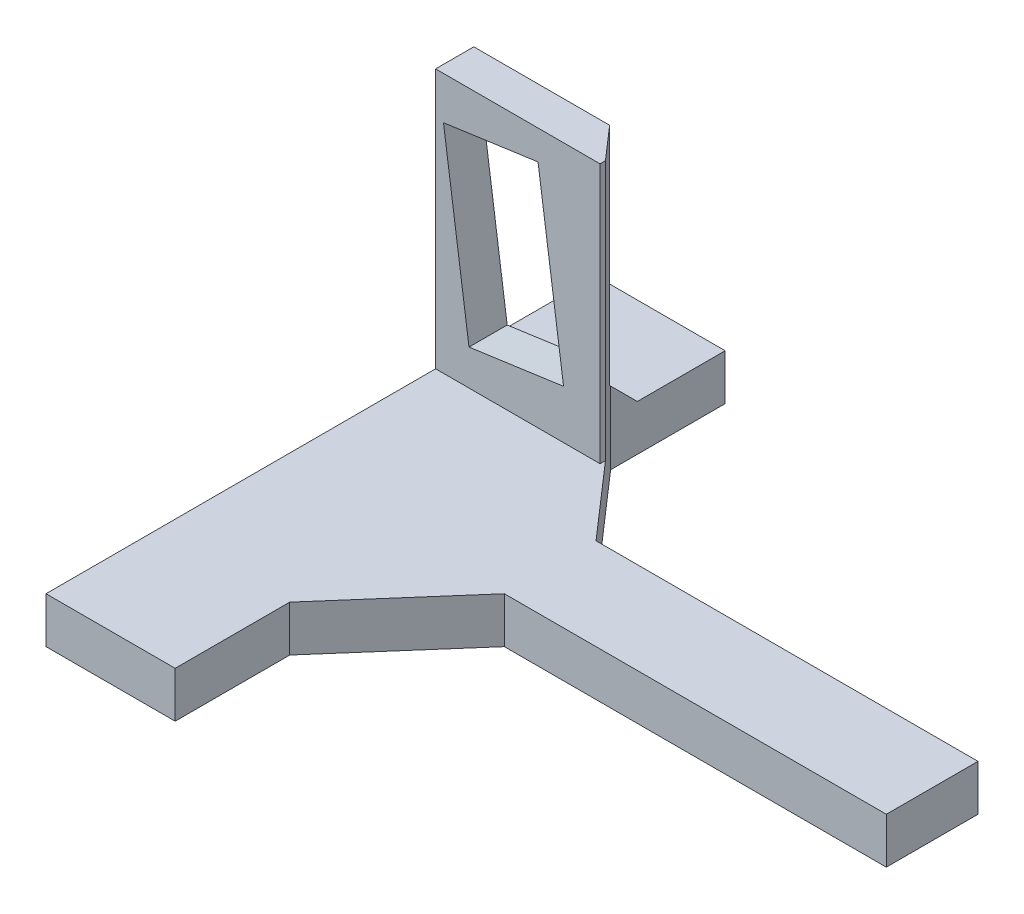
from build123d import *

# Parameters (mm, degrees)
EXTRUDE_1_DEPTH     = 6
EXTRUDE_2_DEPTH     = 34
CUT_EXTRUDE_1_DEPTH = 5
CHAMFER_1_SIZE      = 4.5


with BuildPart() as part:
    # Эскиз1 → Бобышка-Вытянуть1 (new body)
    with BuildSketch(Plane(origin=(0, 0, 0), x_dir=(1, 0, 0), z_dir=(0, 1, 0))):
        Polygon((-49.854690153425345, 33.081252417759906), (-36.76089588655862, 18.081252417759906), (13.239104113441384, 18.08125241775991), (13.239104113441385, 6.081252417759905), (-36.76089588655862, 6.081252417759905), (-49.85469015342534, -8.918747582240094), (-49.85469015342534, -23.918747582240094), (-66.76089588655861, -23.918747582240094), (-66.76089588655861, 6.081252417759901), (-66.76089588655861, 18.081252417759902), (-66.76089588655861, 48.0812524177599), (-49.854690153425345, 48.0812524177599), align=None)
    extrude(amount=EXTRUDE_1_DEPTH)

    # Эскиз2 → Бобышка-Вытянуть2 (add)
    with BuildSketch(Plane(origin=(0, 6, 0), x_dir=(1, 0, 0), z_dir=(0, 1, 0))):
        Polygon((-66.76089588655861, 32.08125241775989), (-48.98177053563421, 32.08125241775989), (-45.2333870796828, 27.787176102421114), (-45.2333870796828, 27.081252417759895), (-66.76089588655861, 27.081252417759895), align=None)
    extrude(amount=EXTRUDE_2_DEPTH)

    # Эскиз3 → Вырез-Вытянуть1 (cut)
    with BuildSketch(Plane(origin=(0, 0, -32.08125241775989), x_dir=(-1, 0, 0), z_dir=(0, 0, -1))):
        Polygon((53.35223499298238, 36.15304870589925), (65.730585852252, 34.413384943898436), (62.39043142921044, 10.646951294100747), (50.012080569940814, 12.386615056101567), align=None)
    extrude(amount=-CUT_EXTRUDE_1_DEPTH, mode=Mode.SUBTRACT)

    # Фаска1
    chamfer_1_edges = [part.edges().sort_by_distance(p)[0] for p in [
        (-57.87133321109641, 6, -32.08125241775989),
    ]]
    chamfer(chamfer_1_edges, length=CHAMFER_1_SIZE)


solid = part.part
